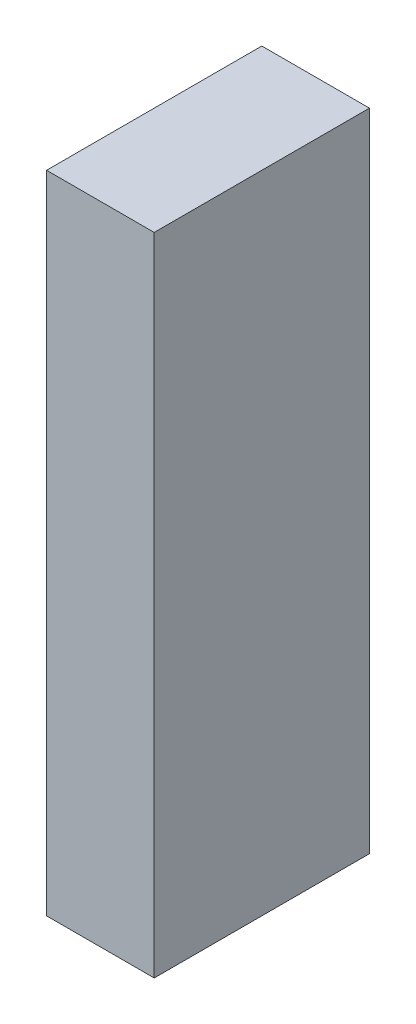
from build123d import *

# Parameters (mm, degrees)
ESQUISSE2_W        = 50.8
ESQUISSE2_H        = 101.6
BOSS_EXTRU_2_DEPTH = 304.8


with BuildPart() as part:
    # Esquisse2 → Boss.-Extru.2 (new body)
    with BuildSketch(Plane(origin=(0, 0, 0), x_dir=(1, 0, 0), z_dir=(0, 1, 0))):
        with Locations((25.4, 50.8)):
            Rectangle(ESQUISSE2_W, ESQUISSE2_H)
    extrude(amount=BOSS_EXTRU_2_DEPTH)


solid = part.part
